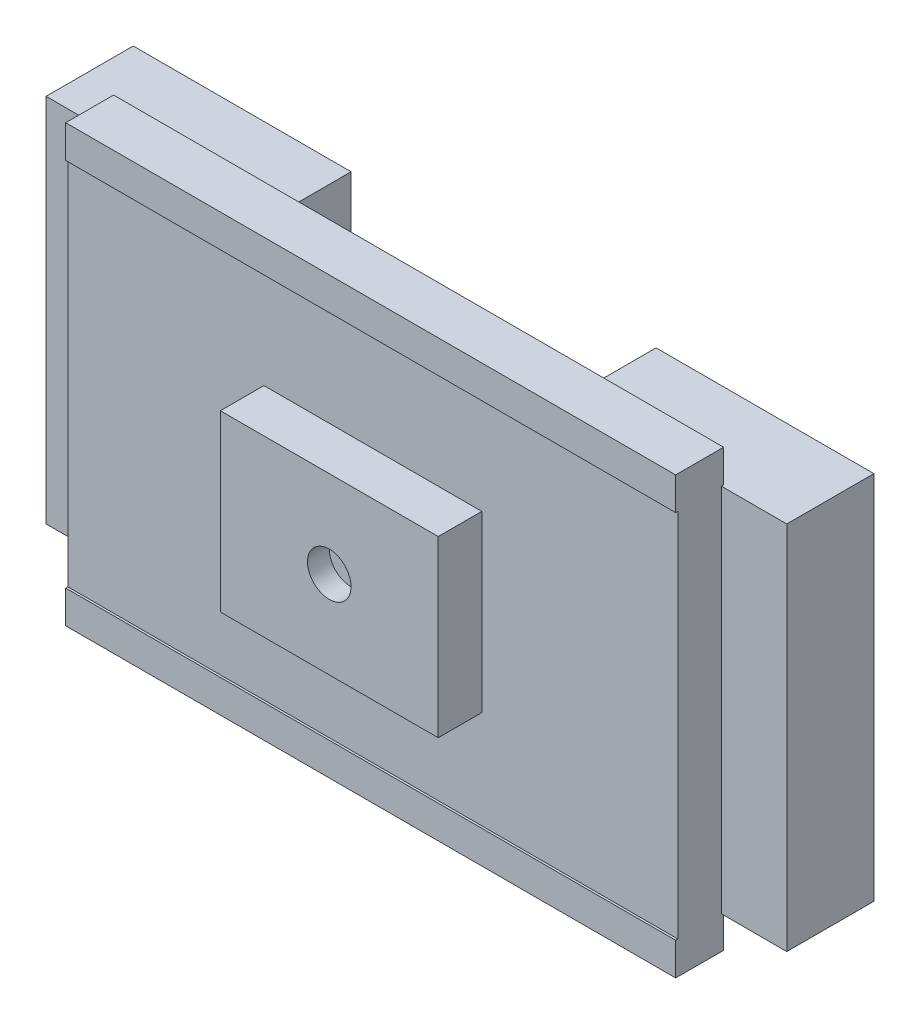
from build123d import *

# Parameters (mm, degrees)
SKETCH1_W                = 14
SKETCH1_H                = 10
BOSS_EXTRUDE1_DEPTH      = 1
SKETCH2_W                = 5
SKETCH2_H                = 4
BOSS_EXTRUDE3_DEPTH      = 1
SKETCH3_W                = 5
SKETCH3_H                = 8.5
BOSS_EXTRUDE4_DEPTH      = 2
SKETCH4_R                = 0.5
CUT_EXTRUDE1_DEPTH       = 0.5
BOSS_EXTRUDE5_DEPTH      = 0.05
BOSS_EXTRUDE5_DEPTH_BACK = 1.05
SKETCH5_W                = 14
SKETCH5_H                = 0.75


with BuildPart() as part:
    # Sketch1 → Boss-Extrude1 (new body)
    with BuildSketch(Plane.XY):
        Rectangle(SKETCH1_W, SKETCH1_H)
    extrude(amount=BOSS_EXTRUDE1_DEPTH)

    # Sketch2 → Boss-Extrude3 (add)
    with BuildSketch(Plane.XY.offset(1)):
        Rectangle(SKETCH2_W, SKETCH2_H)
    extrude(amount=BOSS_EXTRUDE3_DEPTH)

    # Sketch3 → Boss-Extrude4 (add)
    with BuildSketch(Plane(origin=(0, 0, 0), x_dir=(-1, 0, 0), z_dir=(0, 0, -1))):
        with Locations((6, 0)):
            Rectangle(SKETCH3_W, SKETCH3_H)
        with Locations((-6, 0)):
            Rectangle(SKETCH3_W, SKETCH3_H)
    extrude(amount=BOSS_EXTRUDE4_DEPTH)

    # Sketch4 → Cut-Extrude1 (cut)
    with BuildSketch(Plane.XY.offset(2)):
        Circle(SKETCH4_R)
    extrude(amount=-CUT_EXTRUDE1_DEPTH, mode=Mode.SUBTRACT)

    # Sketch5 → Boss-Extrude5 (add, two sides: drawn at the far end of the back side and taken through both)
    with BuildSketch(Plane(origin=(0, 0, 0), x_dir=(-1, 0, 0), z_dir=(0, 0, -1)).offset(-BOSS_EXTRUDE5_DEPTH_BACK)):
        with Locations((0, 4.625)):
            Rectangle(SKETCH5_W, SKETCH5_H)
        with Locations((0, -4.625)):
            Rectangle(SKETCH5_W, SKETCH5_H)
    extrude(amount=BOSS_EXTRUDE5_DEPTH + BOSS_EXTRUDE5_DEPTH_BACK)


solid = part.part
